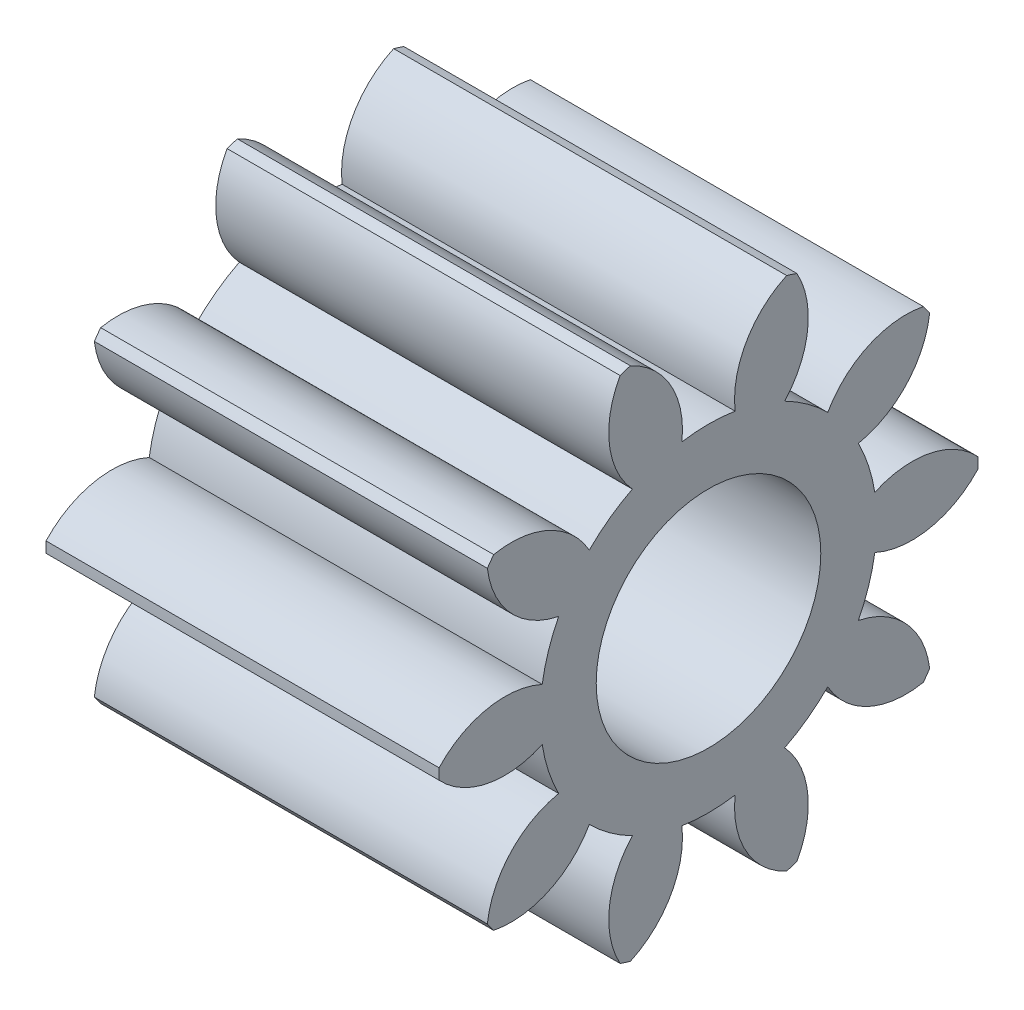
from build123d import *

# Parameters (mm, degrees)
BASPROSKE_W     = 3.5
BASPROSKE_H     = 2.4
TOOTHCUT_DEPTH  = 5.875448697
TEETHCUTS_COUNT = 10
TEETHCUTS_ANGLE = 324
BORSKE_R        = 1
BORE_DEPTH      = 50.0000508


with BuildPart() as part:
    # BasProSke → Base-Revolve (revolve)
    with BuildSketch(Plane(origin=(0, 0, 0), x_dir=(1, 0, 0), z_dir=(0, 1, 0)), mode=Mode.PRIVATE) as base_revolve_sk:
        with Locations((1.75, 1.2)):
            Rectangle(BASPROSKE_W, BASPROSKE_H)
    revolve(base_revolve_sk.sketch.rotate(Axis((-10, 0, 0), (1, 0, 0)), 180), axis=Axis((-10, 0, 0), (1, 0, 0)))

    # TooCutSke → ToothCut (cut, through all)
    with BuildSketch(Plane(origin=(0, 0, 0), x_dir=(0, 0, -1), z_dir=(1, 0, 0))):
        with BuildLine():
            ThreePointArc((0.236921703, 1.480158474), (0, 1.499), (-0.236921703, 1.480158474))
            ThreePointArc((-0.236921703, 1.480158474), (-0.344088585, 1.979623237), (-0.731644645, 2.312414598))
            ThreePointArc((-0.731644645, 2.312414598), (0, 2.4254), (0.731644645, 2.312414598))
            ThreePointArc((0.731644645, 2.312414598), (0.344088585, 1.979623237), (0.236921703, 1.480158474))
        make_face()
    toothcut = extrude(amount=TOOTHCUT_DEPTH, mode=Mode.SUBTRACT)

    # TeethCuts: ToothCut ×10 about axis
    teethcuts_axis = Axis((-10, 0, 0), (1, 0, 0))
    for i in range(1, TEETHCUTS_COUNT):
        add(toothcut.rotate(teethcuts_axis, i * TEETHCUTS_ANGLE / (TEETHCUTS_COUNT - 1)), mode=Mode.SUBTRACT)

    # BorSke → Bore (cut, symmetric)
    with BuildSketch(Plane(origin=(0, 0, 0), x_dir=(0, 0, -1), z_dir=(1, 0, 0))):
        with Locations(Location((0, 0, 0), (0, 0, 180))):
            Circle(BORSKE_R)
    extrude(amount=BORE_DEPTH, both=True, mode=Mode.SUBTRACT)


solid = part.part
